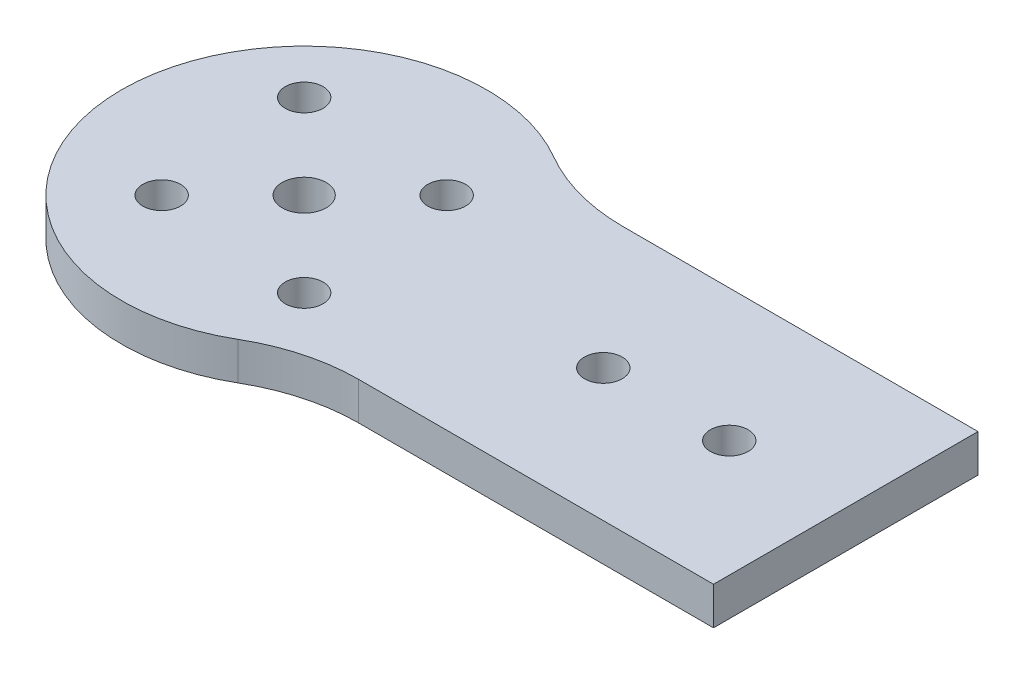
from build123d import *

# Parameters (mm, degrees)
SKETCH1_R           = 14.5
SKETCH1_R_2         = 1.5
SKETCH1_W           = 33
SKETCH1_H           = 21
BOSS_EXTRUDE1_DEPTH = 3
FILLET1_R           = 15
SKETCH2_R           = 1.5
CUT_EXTRUDE1_DEPTH  = 3
SKETCH4_R           = 1.75
CUT_EXTRUDE2_DEPTH  = 10


with BuildPart() as part:
    # Sketch1 → Boss-Extrude1 (new body)
    # profile 1 of 2: a face of its own
    with BuildSketch(Plane(origin=(0, 0, 0), x_dir=(1, 0, 0), z_dir=(0, 1, 0))):
        Circle(SKETCH1_R)
        with Locations(Location((-6.717514421, 6.717514421, 0), (0, 0, 270))):
            Circle(SKETCH1_R_2, mode=Mode.SUBTRACT)
        with Locations(Location((5.656854249, 5.656854249, 0), (0, 0, 270))):
            Circle(SKETCH1_R_2, mode=Mode.SUBTRACT)
        with Locations(Location((-5.656854249, -5.656854249, 0), (0, 0, 270))):
            Circle(SKETCH1_R_2, mode=Mode.SUBTRACT)
        with Locations(Location((6.717514421, -6.717514421, 0), (0, 0, 270))):
            Circle(SKETCH1_R_2, mode=Mode.SUBTRACT)
    # profile 2 of 2: a face of its own
    with BuildSketch(Plane(origin=(0, 0, 0), x_dir=(1, 0, 0), z_dir=(0, 1, 0))):
        with Locations((26.5, 0)):
            Rectangle(SKETCH1_W, SKETCH1_H)
    extrude(amount=BOSS_EXTRUDE1_DEPTH)

    # Fillet1
    fillet1_edges = [part.edges().sort_by_distance(p)[0] for p in [
        (10, 1.5, -10.5),
        (10, 1.5, 10.5),
    ]]
    fillet(fillet1_edges, radius=FILLET1_R)

    # Sketch2 → Cut-Extrude1 (cut)
    with BuildSketch(Plane(origin=(0, 3, 0), x_dir=(1, 0, 0), z_dir=(0, 1, 0))):
        with Locations(Location((23.75, 0, 0), (0, 0, 270))):
            Circle(SKETCH2_R)
        with Locations(Location((33.75, 0, 0), (0, 0, 270))):
            Circle(SKETCH2_R)
    extrude(amount=-CUT_EXTRUDE1_DEPTH, mode=Mode.SUBTRACT)

    # Sketch4 → Cut-Extrude2 (cut)
    with BuildSketch(Plane(origin=(0, 3, 0), x_dir=(1, 0, 0), z_dir=(0, 1, 0))):
        with Locations(Location((0, 0, 0), (0, 0, 270))):
            Circle(SKETCH4_R)
    extrude(amount=-CUT_EXTRUDE2_DEPTH, mode=Mode.SUBTRACT)


solid = part.part
